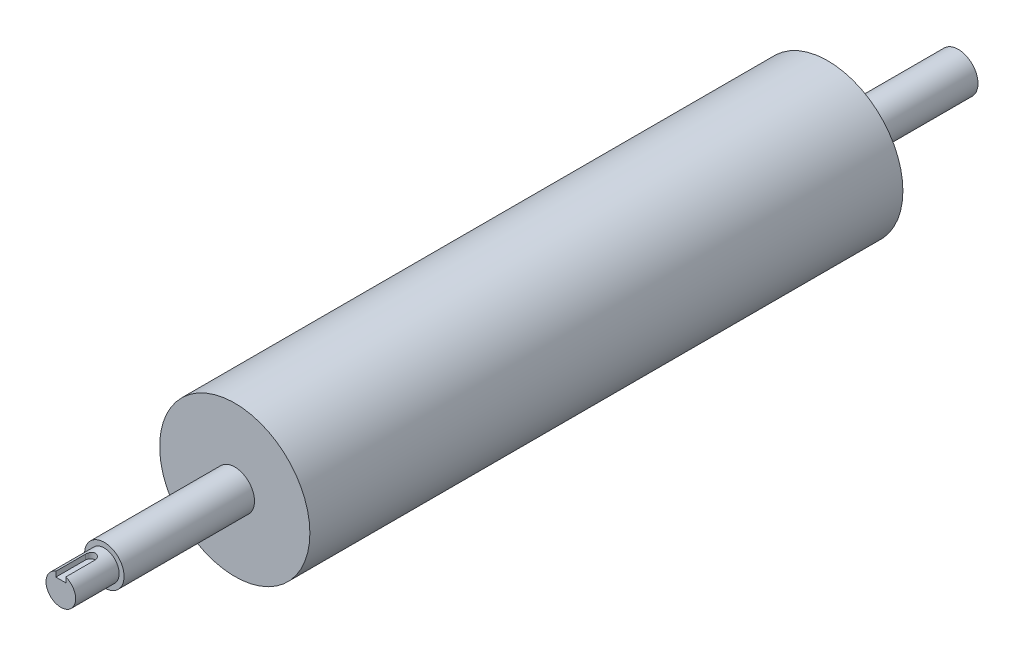
from build123d import *

# Parameters (mm, degrees)
SKETCH_1_R          = 38
EXTRUDE_1_DEPTH     = 150
SKETCH_2_R          = 10
EXTRUDE_2_DEPTH     = 66
SKETCH_3_R          = 7.5
EXTRUDE_3_DEPTH     = 22
CUT_EXTRUDE_START   = 7.5
CUT_EXTRUDE_1_DEPTH = 3


with BuildPart() as part:
    # 草图1 → 凸台-拉伸1 (new, symmetric)
    with BuildSketch(Plane.XY):
        Circle(SKETCH_1_R)
    extrude(amount=EXTRUDE_1_DEPTH, both=True)

    # 草图2 → 凸台-拉伸2 (add)
    with BuildSketch(Plane.XY.offset(150)):
        Circle(SKETCH_2_R)
    extrude_2 = extrude(amount=EXTRUDE_2_DEPTH)

    # 镜向1: 凸台-拉伸2 across plane
    add(extrude_2.mirror(Plane.XY))

    # 草图3 → 凸台-拉伸3 (add)
    with BuildSketch(Plane.XY.offset(216)):
        Circle(SKETCH_3_R)
    extrude(amount=EXTRUDE_3_DEPTH)

    # 草图4 → 切除-拉伸1 (cut)
    with BuildSketch(Plane(origin=(0, 0, 0), x_dir=(1, 0, 0), z_dir=(0, 1, 0)).offset(CUT_EXTRUDE_START)):
        with BuildLine():
            Line((-2.5, -238), (-2.5, -223))
            ThreePointArc((-2.5, -223), (0, -220.5), (2.5, -223))
            Line((2.5, -223), (2.5, -238))
            ThreePointArc((2.5, -238), (0, -240.5), (-2.5, -238))
        make_face()
    extrude(amount=-CUT_EXTRUDE_1_DEPTH, mode=Mode.SUBTRACT)


solid = part.part
